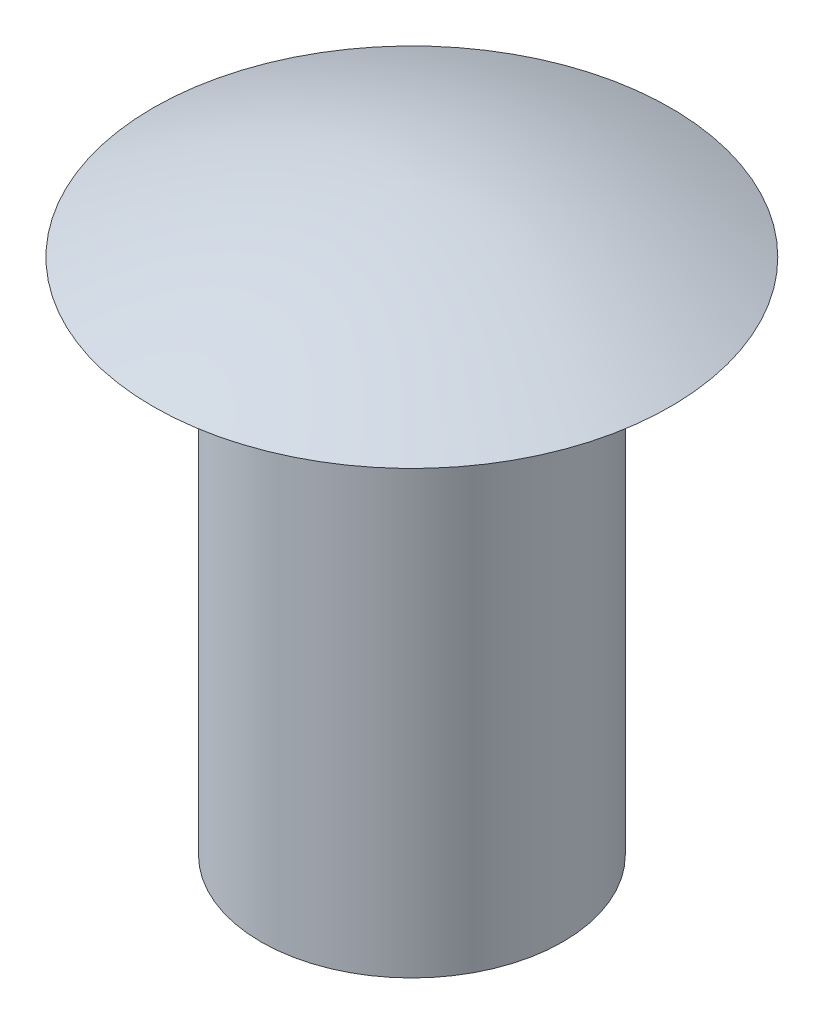
from build123d import *

# Parameters (mm, degrees)
SKETCH1_R           = 1.75
BOSS_EXTRUDE1_DEPTH = 6


with BuildPart() as part:
    # Sketch1 → Boss-Extrude1 (new body)
    with BuildSketch(Plane(origin=(0, 0, 0), x_dir=(1, 0, 0), z_dir=(0, 1, 0))):
        with Locations(Location((0, 0, 0), (0, 0, 270))):
            Circle(SKETCH1_R)
    extrude(amount=BOSS_EXTRUDE1_DEPTH)

    # Sketch2 → Revolve1 (revolve)
    with BuildSketch(Plane.XY):
        with BuildLine():
            Line((0, 6), (-3, 6))
            add(Edge.make_bspline(
                [(-3, 6), (-2.062517582, 6.434471516), (-1.144620798, 6.765922662), (0, 6.796872641)],
                knots=[0, 0, 0, 0, 1, 1, 1, 1], degree=3))
            Line((0, 6.796872641), (0, 6))
        make_face()
    revolve(axis=Axis((0, 6.796872641, 0), (0, -1, 0)))


solid = part.part
